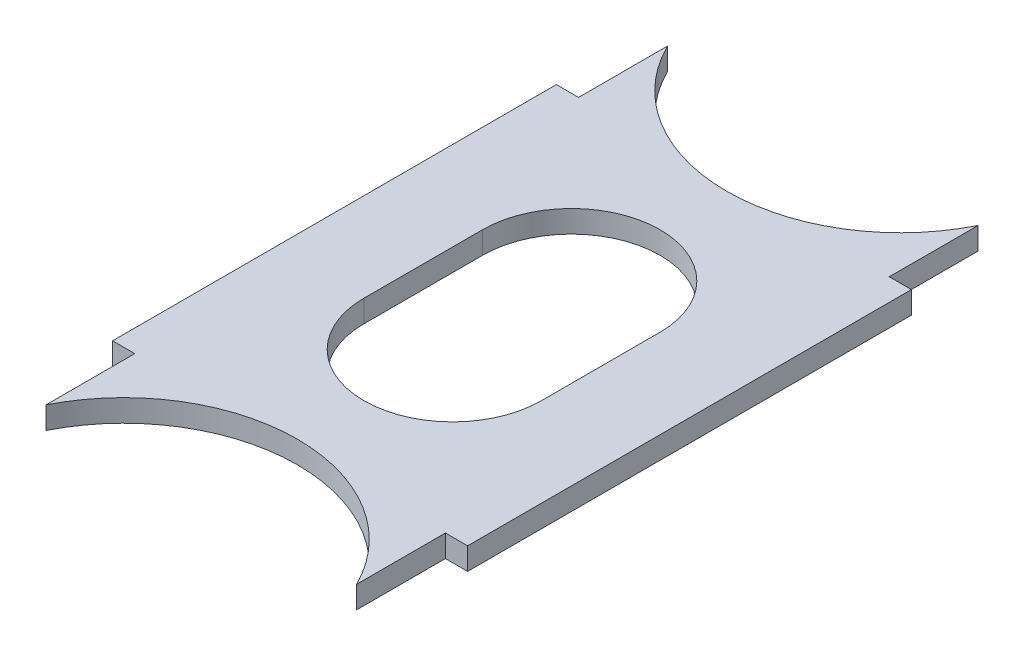
from build123d import *

# Parameters (mm, degrees)
SKETCH1_W           = 1.5875
SKETCH1_H           = 31.75
BOSS_EXTRUDE1_DEPTH = 1.5875


with BuildPart() as part:
    # Sketch1 → Boss-Extrude1 (new body)
    # profile 1 of 3: a face of its own
    with BuildSketch(Plane(origin=(0, 0, 0), x_dir=(1, 0, 0), z_dir=(0, 1, 0))):
        with BuildLine():
            Line((11.1125, -22.225), (11.1125, -15.875))
            Line((11.1125, -15.875), (11.1125, 15.875))
            Line((11.1125, 15.875), (11.1125, 22.225))
            ThreePointArc((11.1125, 22.225), (0, 15.3570973), (-11.1125, 22.225))
            Line((-11.1125, 22.225), (-11.1125, 15.875))
            Line((-11.1125, 15.875), (-11.1125, -15.875))
            Line((-11.1125, -15.875), (-11.1125, -22.225))
            ThreePointArc((-11.1125, -22.225), (0, -15.3570973), (11.1125, -22.225))
        make_face()
        with BuildLine():
            ThreePointArc((-6.35, 4.2445973), (0, 10.5945973), (6.35, 4.2445973))
            Line((6.35, 4.2445973), (6.35, -4.2445973))
            ThreePointArc((6.35, -4.2445973), (0, -10.5945973), (-6.35, -4.2445973))
            Line((-6.35, -4.2445973), (-6.35, 4.2445973))
        make_face(mode=Mode.SUBTRACT)
    # profile 2 of 3: a face of its own
    with BuildSketch(Plane(origin=(0, 0, 0), x_dir=(1, 0, 0), z_dir=(0, 1, 0))):
        with Locations((-11.90625, 0)):
            Rectangle(SKETCH1_W, SKETCH1_H)
    # profile 3 of 3: a face of its own
    with BuildSketch(Plane(origin=(0, 0, 0), x_dir=(1, 0, 0), z_dir=(0, 1, 0))):
        with Locations((11.90625, 0)):
            Rectangle(SKETCH1_W, SKETCH1_H)
    extrude(amount=BOSS_EXTRUDE1_DEPTH)


solid = part.part
